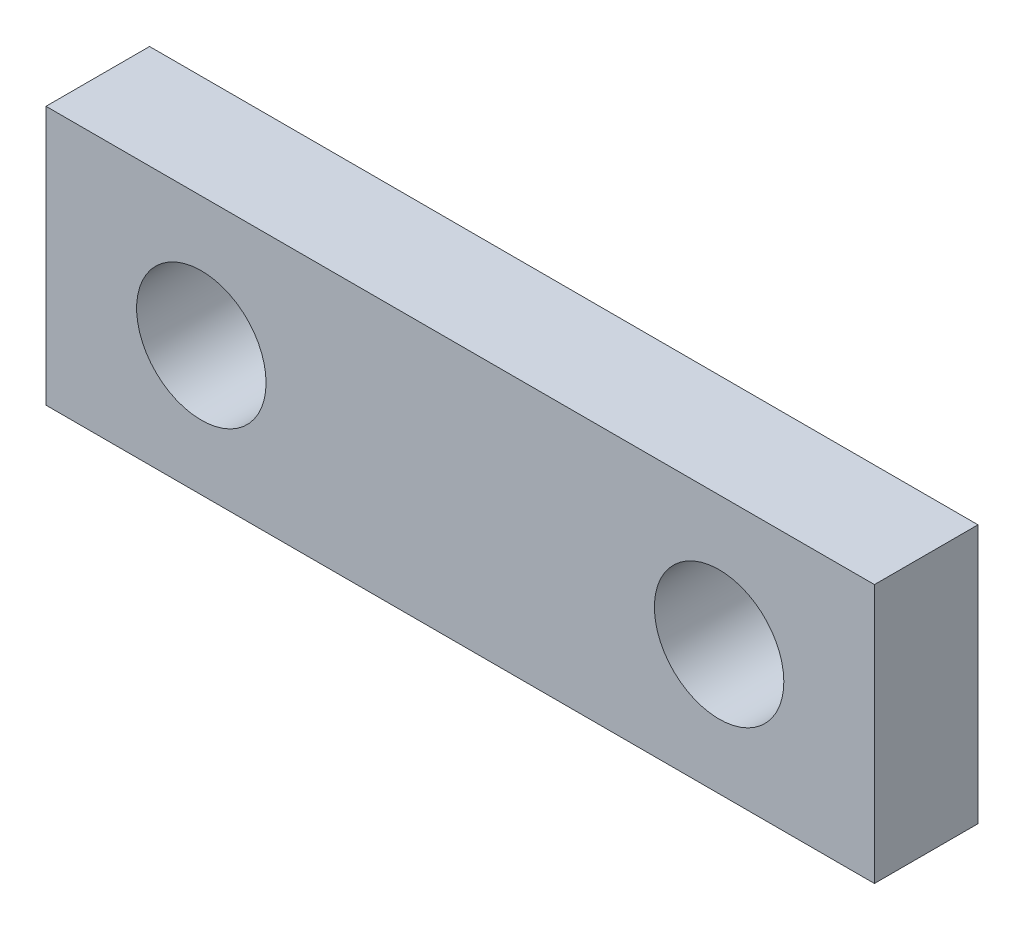
from build123d import *

# Parameters (mm, degrees)
SKIZZE1_W                       = 16
SKIZZE1_H                       = 5
AUFSATZ_LINEAR_AUSTRAGEN1_DEPTH = 2
M3_GEWINDEBOHRUNG1_D            = 2.5


with BuildPart() as part:
    # Skizze1 → Aufsatz-Linear austragen1 (new body)
    with BuildSketch(Plane.XY):
        with Locations((8, 2.5)):
            Rectangle(SKIZZE1_W, SKIZZE1_H)
    extrude(amount=AUFSATZ_LINEAR_AUSTRAGEN1_DEPTH)

    # M3 Gewindebohrung1 (through all)
    with Locations(Plane.XY.offset(2)):
        with Locations((3, 2.5), (13, 2.5)):
            Hole(M3_GEWINDEBOHRUNG1_D / 2)


solid = part.part
